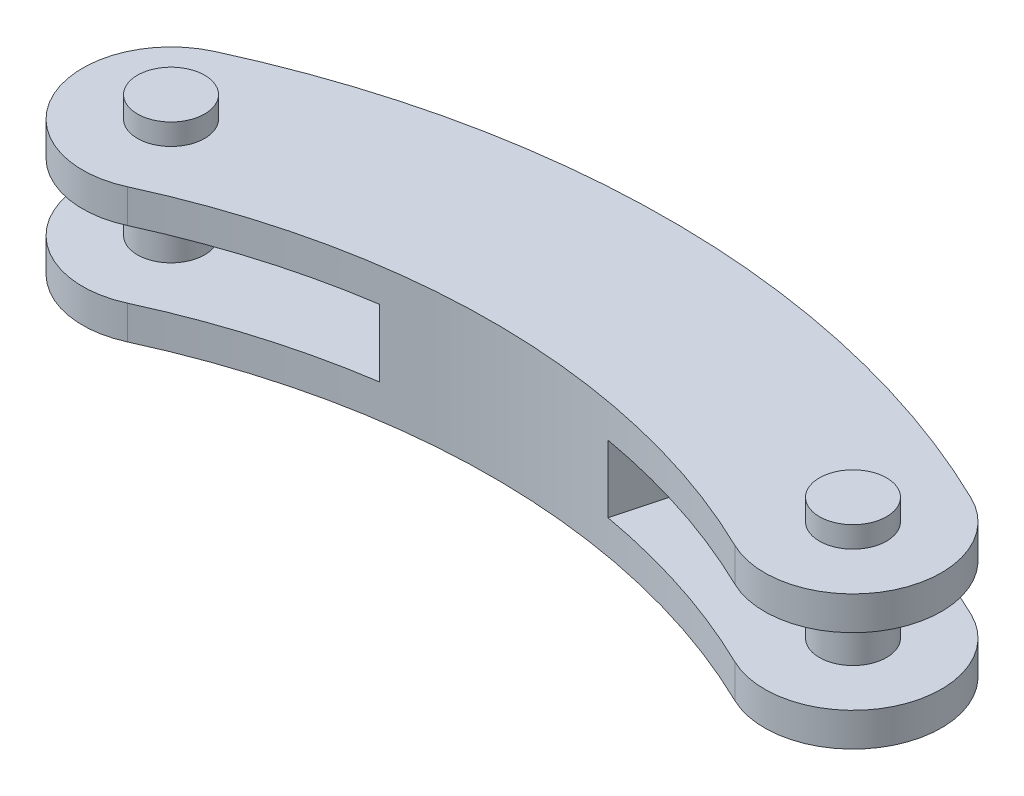
from build123d import *

# Parameters (mm, degrees)
BOSS_EXTRUDE1_DEPTH = 9.5
BOSS_EXTRUDE2_DEPTH = 19
BOSS_EXTRUDE3_DEPTH = 9.5
SKETCH4_R           = 9.5
CUT_EXTRUDE1_DEPTH  = 138.588150993
BOSS_EXTRUDE4_START = 6
SKETCH4_2_R         = 9.5
BOSS_EXTRUDE4_DEPTH = 50


with BuildPart() as part:
    # Sketch1 → Boss-Extrude1 (new body)
    with BuildSketch(Plane(origin=(0, 0, 0), x_dir=(1, 0, 0), z_dir=(0, 1, 0))):
        with BuildLine():
            ThreePointArc((107.722957073, -0.512015135), (-0.194984925, 25.004261154), (-108.658621874, 1.917424631))
            ThreePointArc((-108.658621874, 1.917424631), (-120.938659261, -31.236770908), (-87.784463723, -43.516808294))
            ThreePointArc((-87.784463723, -43.516808294), (-0.756328147, -24.992587685), (85.83395733, -45.466121624))
            ThreePointArc((85.83395733, -45.466121624), (119.255510446, -33.933568251), (107.722957073, -0.512015135))
        make_face()
    extrude(amount=BOSS_EXTRUDE1_DEPTH)

    # Sketch2 → Boss-Extrude2 (add)
    with BuildSketch(Plane(origin=(0, 9.5, 0), x_dir=(1, 0, 0), z_dir=(0, 1, 0))):
        with BuildLine():
            ThreePointArc((-32.906939519, -27.189629795), (-0.088825925, -25.001179802), (32.651934744, -28.141320571))
            Line((32.651934744, -28.141320571), (45.630544935, 20.295512075))
            ThreePointArc((45.630544935, 20.295512075), (-0.094052921, 25.003107796), (-45.915742347, 21.359883308))
            Line((-45.915742347, 21.359883308), (-32.906939519, -27.189629795))
        make_face()
    extrude(amount=BOSS_EXTRUDE2_DEPTH)

    # Sketch3 → Boss-Extrude3 (add)
    with BuildSketch(Plane(origin=(0, 28.5, 0), x_dir=(1, 0, 0), z_dir=(0, 1, 0))):
        with BuildLine():
            ThreePointArc((107.722957073, -0.512015135), (-0.194984925, 25.004261154), (-108.658621874, 1.917424631))
            ThreePointArc((-108.658621874, 1.917424631), (-120.938659261, -31.236770908), (-87.784463723, -43.516808294))
            ThreePointArc((-87.784463723, -43.516808294), (-0.756328147, -24.992587685), (85.83395733, -45.466121624))
            ThreePointArc((85.83395733, -45.466121624), (119.255510446, -33.933568251), (107.722957073, -0.512015135))
        make_face()
    extrude(amount=BOSS_EXTRUDE3_DEPTH)

    # Sketch4 → Cut-Extrude1 (cut, through all)
    with BuildSketch(Plane(origin=(0, 38, 0), x_dir=(1, 0, 0), z_dir=(0, 1, 0))):
        with Locations((-98.221542799, -20.799691832)):
            Circle(SKETCH4_R)
        with Locations((96.778457201, -22.989068379)):
            Circle(SKETCH4_R)
    extrude(amount=-CUT_EXTRUDE1_DEPTH, mode=Mode.SUBTRACT)

    # Sketch4<2> → Boss-Extrude4 (add)
    with BuildSketch(Plane(origin=(0, 38, 0), x_dir=(1, 0, 0), z_dir=(0, 1, 0)).offset(BOSS_EXTRUDE4_START)):
        with Locations((-98.221542799, -20.799691832)):
            Circle(SKETCH4_2_R)
        with Locations((96.778457201, -22.989068379)):
            Circle(SKETCH4_2_R)
    extrude(amount=-BOSS_EXTRUDE4_DEPTH)


solid = part.part
